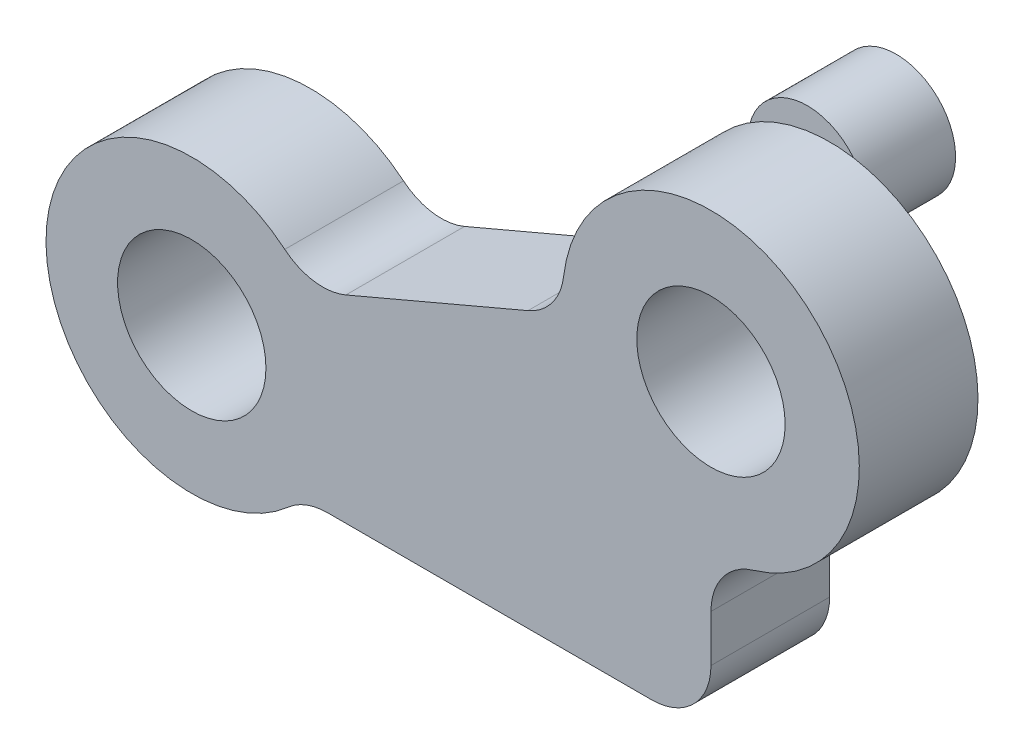
from build123d import *

# Parameters (mm, degrees)
SKETCH1_R           = 2.5
BOSS_EXTRUDE1_DEPTH = 4
FILLET1_R           = 2
BOSS_EXTRUDE2_START = -3.9
SKETCH2_R           = 1
BOSS_EXTRUDE2_DEPTH = 10
SKETCH3_R           = 2
BOSS_EXTRUDE3_DEPTH = 3


with BuildPart() as part:
    # Sketch1 → Boss-Extrude1 (new body)
    with BuildSketch(Plane.XY):
        with BuildLine():
            Line((56.839071038, 28.579919803), (56.839071038, 23.292312115))
            Line((56.839071038, 23.292312115), (43.08257304, 23.292312115))
            ThreePointArc((43.08257304, 23.292312115), (34.429928081, 26.628647856), (43.273147001, 29.420937259))
            Line((43.273147001, 29.420937259), (51.8645252, 33.076041142))
            ThreePointArc((51.8645252, 33.076041142), (60.191727201, 37.289326312), (56.839071038, 28.579919803))
        make_face()
        with Locations((39.340592987, 26.475947236)):
            Circle(SKETCH1_R, mode=Mode.SUBTRACT)
        with Locations((56.839071038, 33.579919803)):
            Circle(SKETCH1_R, mode=Mode.SUBTRACT)
    extrude(amount=BOSS_EXTRUDE1_DEPTH)

    # Fillet1
    fillet1_edges = [part.edges().sort_by_distance(p)[0] for p in [
        (56.839071038, 28.579919803, 2),
        (56.839071038, 23.292312115, 2),
        (43.08257304, 23.292312115, 2),
        (43.273147001, 29.420937259, 2),
        (51.8645252, 33.076041142, 2),
    ]]
    fillet(fillet1_edges, radius=FILLET1_R)

    # Sketch2 → Boss-Extrude2 (add)
    with BuildSketch(Plane.XY.offset(4).offset(BOSS_EXTRUDE2_START)):
        with Locations((46.18381054, 27.359606691)):
            Circle(SKETCH2_R)
    extrude(amount=-BOSS_EXTRUDE2_DEPTH)

    # Sketch3 → Boss-Extrude3 (add)
    with BuildSketch(Plane(origin=(0, 0, -9.9), x_dir=(-1, 0, 0), z_dir=(0, 0, -1))):
        with Locations((-46.18381054, 27.359606691)):
            Circle(SKETCH3_R)
    extrude(amount=BOSS_EXTRUDE3_DEPTH)


solid = part.part
